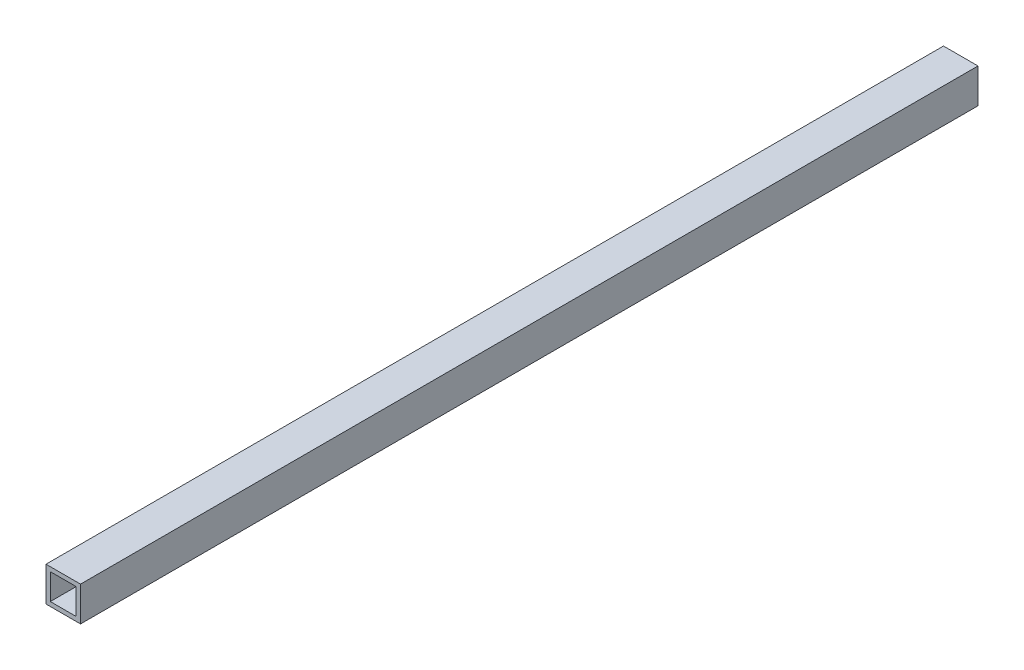
from build123d import *

# Parameters (mm, degrees)
BOSS_EXTRUDE1_DEPTH      = 330.2
BOSS_EXTRUDE1_DEPTH_BACK = 330.2
SKETCH3_W                = 25.4
SKETCH3_H                = 25.4
SKETCH3_W_2              = 19.05
SKETCH3_H_2              = 19.05


with BuildPart() as part:
    # Sketch3 → Boss-Extrude1 (new, two sides: drawn at the far end of the back side and taken through both)
    with BuildSketch(Plane.XY.offset(-BOSS_EXTRUDE1_DEPTH_BACK)):
        Rectangle(SKETCH3_W, SKETCH3_H)
        Rectangle(SKETCH3_W_2, SKETCH3_H_2, mode=Mode.SUBTRACT)
    extrude(amount=BOSS_EXTRUDE1_DEPTH + BOSS_EXTRUDE1_DEPTH_BACK)


solid = part.part
